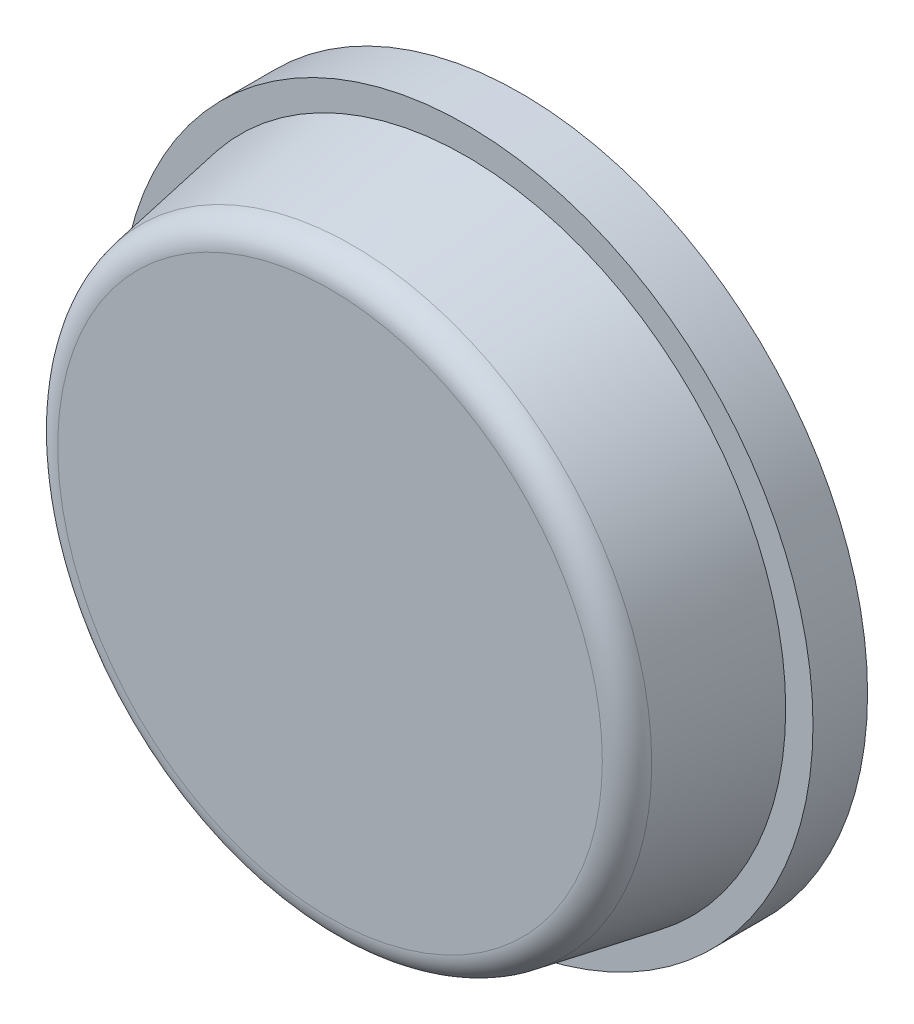
from build123d import *

# Parameters (mm, degrees)
BASE_R                   = 6.35
BOSS_EXTRU_1_BASE_DEPTH  = 1
PATIN_R                  = 5.85
BOSS_EXTRU_2_PATIN_DEPTH = 2.5
BOSS_EXTRU_2_PATIN_TAPER = 10
CONG_1_0_5MM_PATIN_R     = 0.5


with BuildPart() as part:
    # Base → Boss.-Extru.1_Base (new body)
    with BuildSketch(Plane.XY):
        Circle(BASE_R)
    extrude(amount=BOSS_EXTRU_1_BASE_DEPTH)

    # Patin → Boss.-Extru.2_Patin (add)
    with BuildSketch(Plane.XY.offset(1)):
        Circle(PATIN_R)
    extrude(amount=BOSS_EXTRU_2_PATIN_DEPTH, taper=BOSS_EXTRU_2_PATIN_TAPER)

    # Congé1_0.5mm_Patin
    cong_1_0_5mm_patin_edges = [part.edges().sort_by_distance(p)[0] for p in [
        (-5.409182548, 0, 3.5),
    ]]
    fillet(cong_1_0_5mm_patin_edges, radius=CONG_1_0_5MM_PATIN_R)


solid = part.part
